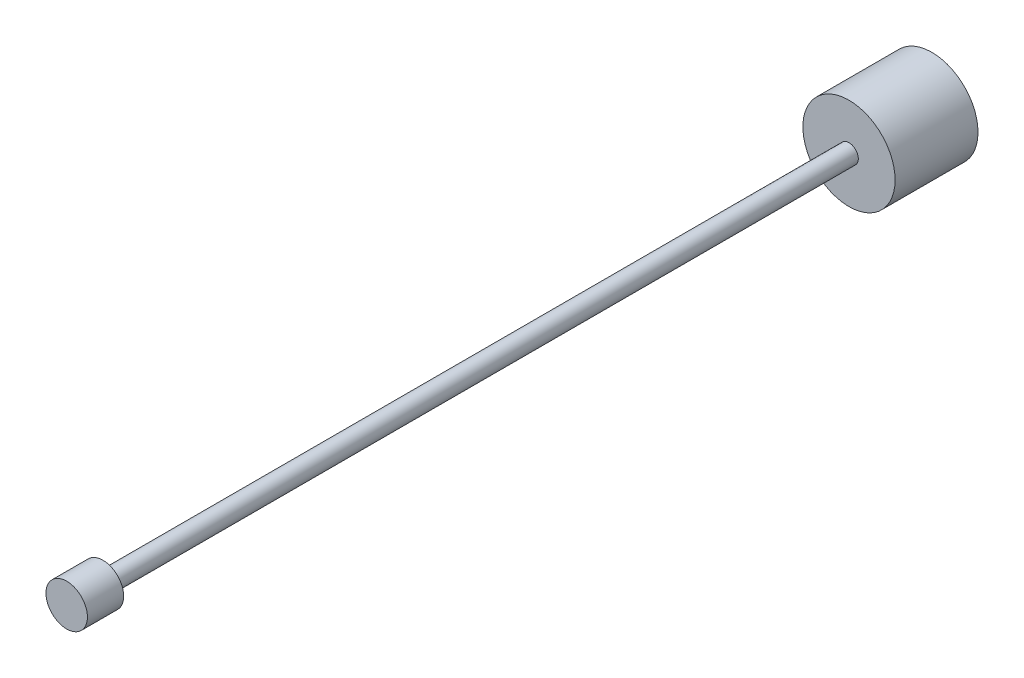
from build123d import *

# Parameters (mm, degrees)
SKETCH1_R           = 8.9
BOSS_EXTRUDE1_DEPTH = 16
SKETCH2_R           = 1.8
BOSS_EXTRUDE2_DEPTH = 144
SKETCH4_R           = 4
BOSS_EXTRUDE3_DEPTH = 7


with BuildPart() as part:
    # Sketch1 → Boss-Extrude1 (new body)
    with BuildSketch(Plane.XY):
        Circle(SKETCH1_R)
    extrude(amount=BOSS_EXTRUDE1_DEPTH)


with BuildPart() as body_2:
    # Sketch2 → Boss-Extrude2 (new body)
    with BuildSketch(Plane.XY.offset(16)):
        Circle(SKETCH2_R)
    extrude(amount=BOSS_EXTRUDE2_DEPTH)

    # Sketch4 → Boss-Extrude3 (add)
    with BuildSketch(Plane.XY.offset(160)):
        Circle(SKETCH4_R)
    extrude(amount=BOSS_EXTRUDE3_DEPTH)


solid = Compound([part.part, body_2.part])
